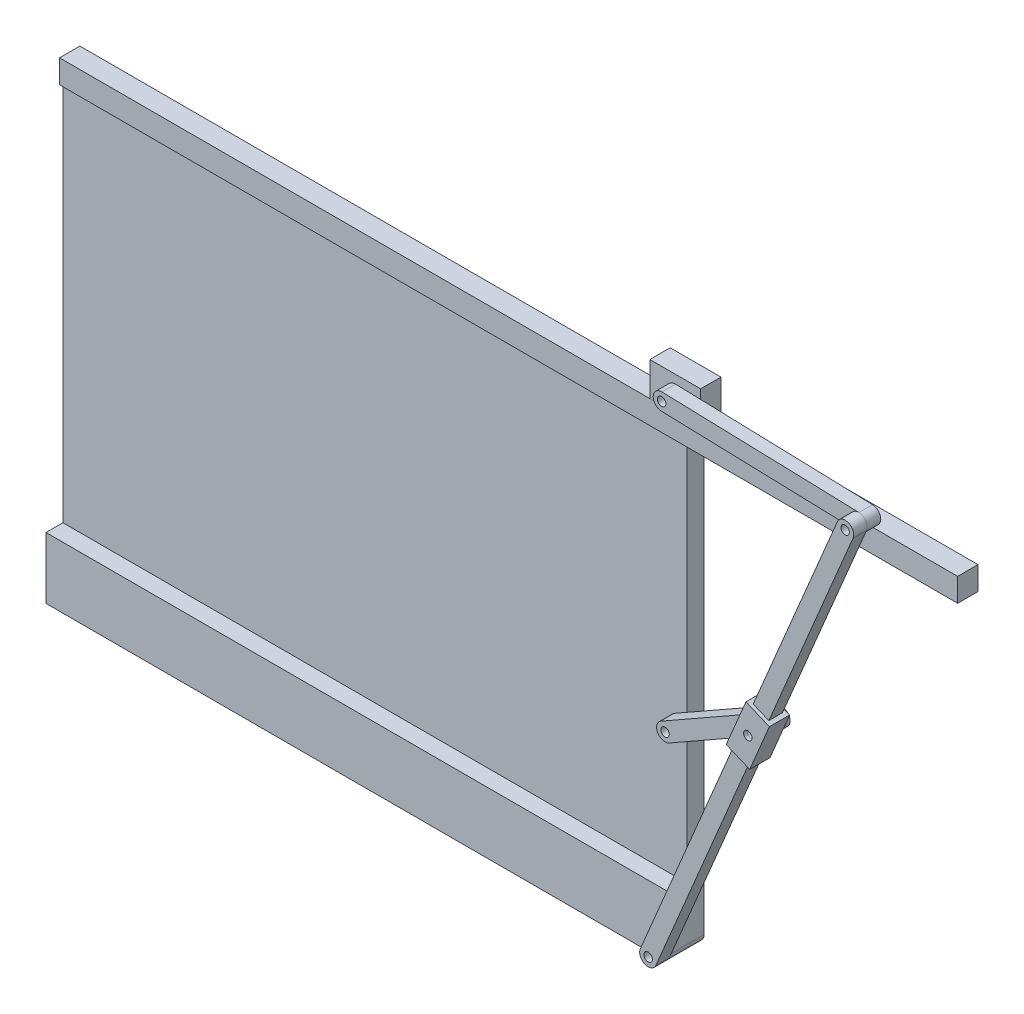
from build123d import *

# Parameters (mm, degrees)
BOSS_EXTRUDE2_DEPTH     = 8
BOSS_EXTRUDE5_DEPTH     = 12
SKETCH6_W               = 10
SKETCH6_H               = 7.997952507
CUT_EXTRUDE1_DEPTH      = 35
BOSS_EXTRUDE6_DEPTH     = 8
BOSS_EXTRUDE7_DEPTH     = 8
SKETCH10_W              = 30
SKETCH10_H              = 20
BOSS_EXTRUDE9_DEPTH     = 12
CUT_EXTRUDE5_DEPTH      = 316.00051937
CUT_EXTRUDE5_DEPTH_BACK = 316.00051937
SKETCH16_R              = 2.5
BOSS_EXTRUDE10_DEPTH    = 10
SKETCH14_W              = 530.258658084
SKETCH14_H              = 13.787893997
BOSS_EXTRUDE11_DEPTH    = 2
BOSS_EXTRUDE12_DEPTH    = 10
CUT_EXTRUDE2_DEPTH      = 466.439357436
CUT_EXTRUDE2_DEPTH_BACK = 466.439357436
SKETCH11_R              = 2.5


with BuildPart() as part:
    # Sketch3 → Boss-Extrude2 (new body)
    with BuildSketch(Plane.XY):
        with BuildLine():
            Line((-2.472101251, 114.346114978), (58.373508448, 148.955532489))
            ThreePointArc((58.373508448, 148.955532489), (65.191724677, 147.081518762), (63.317710949, 140.263302532))
            Line((63.317710949, 140.263302532), (2.472101251, 105.653885022))
            ThreePointArc((2.472101251, 105.653885022), (-4.346114978, 107.527898749), (-2.472101251, 114.346114978))
        make_face()
    extrude(amount=BOSS_EXTRUDE2_DEPTH)


with BuildPart() as body_2:
    # Sketch5 → Boss-Extrude5 (new body)
    with BuildSketch(Plane.XY.offset(8)):
        Polygon((59.750014801, 161.344102205), (73.576000516, 155.526704245), (61.941204595, 127.874732816), (48.115218881, 133.692130777), align=None)
    extrude(amount=BOSS_EXTRUDE5_DEPTH)

    # Sketch6 → Cut-Extrude1 (cut)
    with BuildSketch(Plane(origin=(66.663007659, 158.435403225, 0), x_dir=(0.921732380952381, -0.387826530685892, 0), z_dir=(0.387826530685892, 0.921732380952381, 0))):
        with Locations((0, -14.001023746)):
            Rectangle(SKETCH6_W, SKETCH6_H)
    extrude(amount=-CUT_EXTRUDE1_DEPTH, mode=Mode.SUBTRACT)


with BuildPart() as body_3:
    # Sketch8 → Boss-Extrude6 (new body)
    with BuildSketch(Plane.XY.offset(10.002047493)):
        with BuildLine():
            Line((-4.608661905, 1.939132653), (111.739297301, 278.458846939))
            ThreePointArc((111.739297301, 278.458846939), (118.287091859, 281.12837619), (120.956621111, 274.580581632))
            Line((120.956621111, 274.580581632), (4.608661905, -1.939132653))
            ThreePointArc((4.608661905, -1.939132653), (-1.939132653, -4.608661905), (-4.608661905, 1.939132653))
        make_face()
    extrude(amount=BOSS_EXTRUDE6_DEPTH)


with BuildPart() as body_4:
    # Sketch9 → Boss-Extrude7 (new body)
    with BuildSketch(Plane(origin=(0, 0, 10.002047493), x_dir=(-1, 0, 0), z_dir=(0, 0, -1))):
        with BuildLine():
            Line((-116.497456015, 281.517478856), (-0.149496809, 284.997764571))
            ThreePointArc((-0.149496809, 284.997764571), (4.997764571, 280.149496809), (0.149496809, 275.002235429))
            Line((0.149496809, 275.002235429), (-116.198462397, 271.521949715))
            ThreePointArc((-116.198462397, 271.521949715), (-121.345723776, 276.370217477), (-116.497456015, 281.517478856))
        make_face()
    extrude(amount=BOSS_EXTRUDE7_DEPTH)


with BuildPart() as body_5:
    # Sketch10 → Boss-Extrude9 (new body)
    with BuildSketch(Plane(origin=(0, 0, 2.002047493), x_dir=(-1, 0, 0), z_dir=(0, 0, -1))):
        with Locations((0, 280)):
            Rectangle(SKETCH10_W, SKETCH10_H)
    extrude(amount=BOSS_EXTRUDE9_DEPTH)


with BuildPart() as cut_extrude5_tool:
    # Sketch16 → Cut-Extrude5 (new, two sides: drawn at the far end of the back side and taken through both)
    with BuildSketch(Plane.XY.offset(-CUT_EXTRUDE5_DEPTH_BACK)):
        with Locations((0, 280)):
            Circle(SKETCH16_R)
        with Locations(Location((116.347959206, 276.519714286, 0), (0, 0, 180))):
            Circle(SKETCH16_R)
        with Locations((0, 110)):
            Circle(SKETCH16_R)
        Circle(SKETCH16_R)
        with Locations((60.845609698, 144.609417511)):
            Circle(SKETCH16_R)
    extrude(amount=CUT_EXTRUDE5_DEPTH + CUT_EXTRUDE5_DEPTH_BACK)


with BuildPart() as part_1:
    add(part.part)

    # Cut-Extrude5: cut by cut_extrude5_tool
    add(cut_extrude5_tool.part, mode=Mode.SUBTRACT)


with BuildPart() as body_2_1:
    add(body_2.part)

    # Cut-Extrude5: cut by cut_extrude5_tool
    add(cut_extrude5_tool.part, mode=Mode.SUBTRACT)


with BuildPart() as body_3_1:
    add(body_3.part)

    # Cut-Extrude5: cut by cut_extrude5_tool
    add(cut_extrude5_tool.part, mode=Mode.SUBTRACT)


with BuildPart() as body_4_1:
    add(body_4.part)

    # Cut-Extrude5: cut by cut_extrude5_tool
    add(cut_extrude5_tool.part, mode=Mode.SUBTRACT)


with BuildPart() as body_5_1:
    add(body_5.part)

    # Cut-Extrude5: cut by cut_extrude5_tool
    add(cut_extrude5_tool.part, mode=Mode.SUBTRACT)


with BuildPart() as body_6:
    # Sketch12 → Boss-Extrude10 (new body)
    with BuildSketch(Plane.XY):
        with BuildLine():
            Line((166.756532299, 270), (-363.502125785, 270))
            Line((-363.502125785, 270), (-363.502125785, -5))
            Line((-363.502125785, -5), (0, -5))
            ThreePointArc((0, -5), (3.535533906, -3.535533906), (5, 0))
            Line((5, 0), (5, 256.212106003))
            Line((5, 256.212106003), (166.756532299, 256.212106003))
            Line((166.756532299, 256.212106003), (166.756532299, 270))
        make_face()
    extrude(amount=-BOSS_EXTRUDE10_DEPTH)

    # Sketch14 → Boss-Extrude11 (add)
    with BuildSketch(Plane.XY):
        with Locations((-98.372796743, 263.106053002)):
            Rectangle(SKETCH14_W, SKETCH14_H)
    extrude(amount=BOSS_EXTRUDE11_DEPTH)

    # Sketch15 → Boss-Extrude12 (add)
    with BuildSketch(Plane.XY):
        with BuildLine():
            Line((-363.502125785, 31.29174962), (5, 31.29174962))
            Line((5, 31.29174962), (5, 0))
            ThreePointArc((5, 0), (3.535533906, -3.535533906), (0, -5))
            Line((0, -5), (-363.502125785, -5))
            Line((-363.502125785, -5), (-363.502125785, 31.29174962))
        make_face()
    extrude(amount=BOSS_EXTRUDE12_DEPTH)

    # Sketch11 → Cut-Extrude2 (cut, two sides: drawn at the far end of the back side and taken through both)
    with BuildSketch(Plane.XY.offset(-CUT_EXTRUDE2_DEPTH_BACK)):
        with Locations((0, 280)):
            Circle(SKETCH11_R)
        with Locations(Location((116.347959206, 276.519714286, 0), (0, 0, 180))):
            Circle(SKETCH11_R)
        with Locations((60.845609698, 144.609417511)):
            Circle(SKETCH11_R)
        with Locations((0, 110)):
            Circle(SKETCH11_R)
        Circle(SKETCH11_R)
    extrude(amount=CUT_EXTRUDE2_DEPTH + CUT_EXTRUDE2_DEPTH_BACK, mode=Mode.SUBTRACT)


solid = Compound([part_1.part, body_2_1.part, body_3_1.part, body_4_1.part, body_5_1.part, body_6.part])
